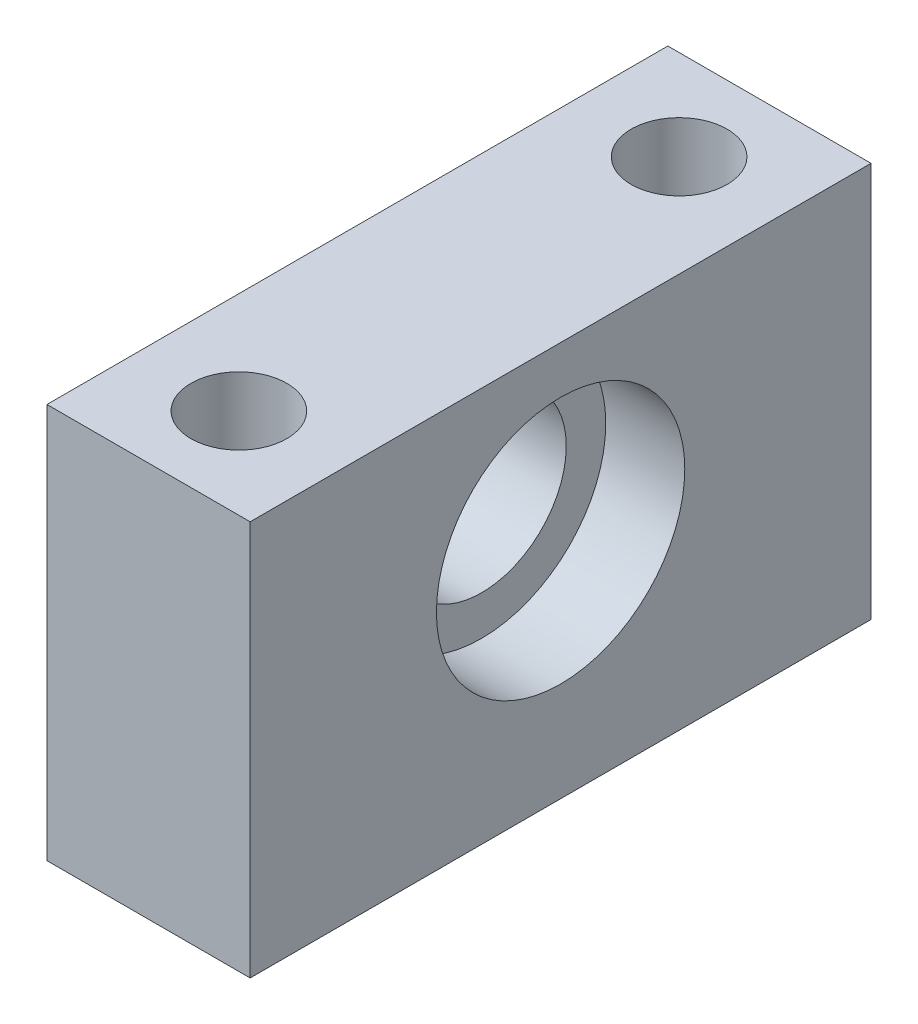
from build123d import *

# Parameters (mm, degrees)
ESQUISSE1_W             = 55
ESQUISSE1_H             = 35
BOSS_EXTRU_1_DEPTH      = 18
ESQUISSE2_R             = 11
ENL_V_MAT_EXTRU_1_DEPTH = 7
ESQUISSE3_R             = 7.5
ENL_V_MAT_EXTRU_2_DEPTH = 302.152136256
ESQUISSE4_R             = 2
ENL_V_MAT_EXTRU_3_DEPTH = 299.279472876
ESQUISSE5_R             = 4.25
ENL_V_MAT_EXTRU_4_DEPTH = 12


with BuildPart() as part:
    # Esquisse1 → Boss.-Extru.1 (new body)
    with BuildSketch(Plane(origin=(0, 0, 0), x_dir=(0, 0, -1), z_dir=(1, 0, 0))):
        with Locations((-268.171513574, -36.785957969)):
            Rectangle(ESQUISSE1_W, ESQUISSE1_H)
    extrude(amount=BOSS_EXTRU_1_DEPTH)

    # Esquisse2 → Enlèv. mat.-Extru.1 (cut)
    with BuildSketch(Plane(origin=(18, 0, 0), x_dir=(0, 0, -1), z_dir=(1, 0, 0))):
        with Locations((-268.171513574, -34.485781453)):
            Circle(ESQUISSE2_R)
    extrude(amount=-ENL_V_MAT_EXTRU_1_DEPTH, mode=Mode.SUBTRACT)

    # Esquisse3 → Enlèv. mat.-Extru.2 (cut, through all)
    with BuildSketch(Plane.ZY):
        with Locations((268.171513574, -34.485781453)):
            Circle(ESQUISSE3_R)
    extrude(amount=-ENL_V_MAT_EXTRU_2_DEPTH, mode=Mode.SUBTRACT)

    # Esquisse4 → Enlèv. mat.-Extru.3 (cut, through all)
    with BuildSketch(Plane(origin=(0, -19.285957969, 0), x_dir=(1, 0, 0), z_dir=(0, 1, 0))):
        with Locations(Location((9, -287.671513574, 0), (0, 0, 270))):
            Circle(ESQUISSE4_R)
        with Locations(Location((9, -248.671513574, 0), (0, 0, 270))):
            Circle(ESQUISSE4_R)
    extrude(amount=-ENL_V_MAT_EXTRU_3_DEPTH, mode=Mode.SUBTRACT)

    # Esquisse5 → Enlèv. mat.-Extru.4 (cut)
    with BuildSketch(Plane(origin=(0, -19.285957969, 0), x_dir=(1, 0, 0), z_dir=(0, 1, 0))):
        with Locations(Location((9, -287.671513574, 0), (0, 0, 270))):
            Circle(ESQUISSE5_R)
        with Locations(Location((9, -248.671513574, 0), (0, 0, 270))):
            Circle(ESQUISSE5_R)
    extrude(amount=-ENL_V_MAT_EXTRU_4_DEPTH, mode=Mode.SUBTRACT)


solid = part.part
